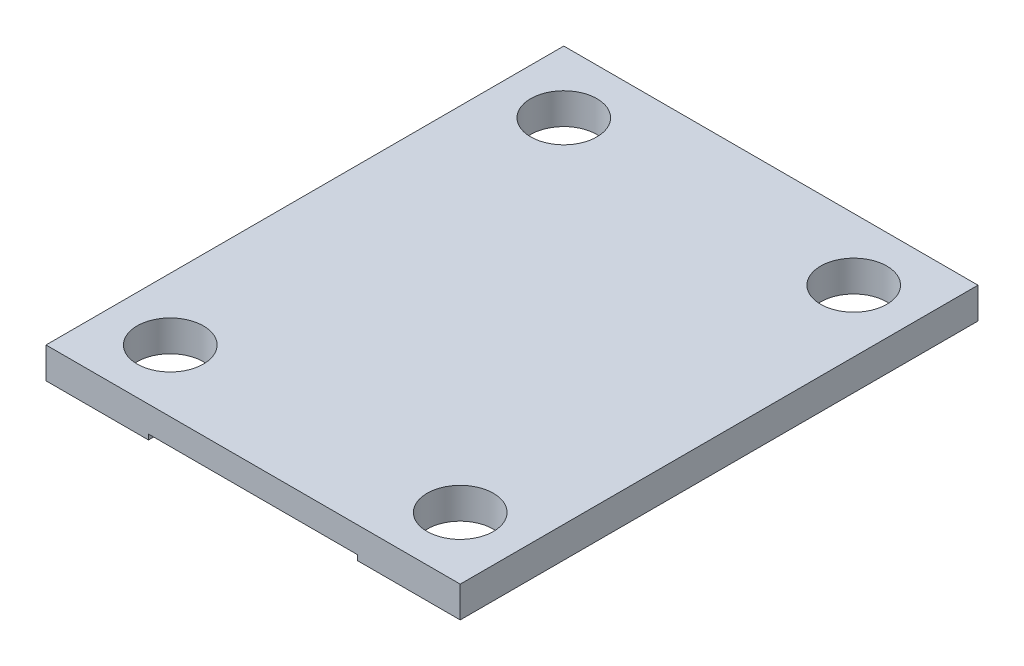
from build123d import *

# Parameters (mm, degrees)
SKETCH_1_W              = 20
SKETCH_1_H              = 25
EXTRUDE_1_DEPTH         = 1.5
SKETCH_2_W              = 10.1
SKETCH_2_H              = 17.5
CUT_EXTRUDE_1_DEPTH     = 0.25
HOLE_WIZARD_3_2_3_2_1_D = 3.2
HOLE_WIZARD_3_2_3_2_2_D = 3.2


with BuildPart() as part:
    # 草图1 → 凸台-拉伸1 (new body)
    with BuildSketch(Plane.XZ):
        with Locations((0, -2.5)):
            Rectangle(SKETCH_1_W, SKETCH_1_H)
    extrude(amount=-EXTRUDE_1_DEPTH)

    # 草图2 → 切除-拉伸1 (cut)
    with BuildSketch(Plane.XZ):
        with Locations((0, 1.25)):
            Rectangle(SKETCH_2_W, SKETCH_2_H)
    extrude(amount=-CUT_EXTRUDE_1_DEPTH, mode=Mode.SUBTRACT)

    # Ø3.2 (3.2) 直径孔1 (through all)
    with Locations(Plane(origin=(0, 0, 0), x_dir=(-1, 0, 0), z_dir=(0, -1, 0))):
        with Locations((-7, -7), (-7, 12)):
            Hole(HOLE_WIZARD_3_2_3_2_1_D / 2)

    # Ø3.2 (3.2) 直径孔2 (through all)
    with Locations(Plane(origin=(0, 1.5, 0), x_dir=(1, 0, 0), z_dir=(0, 1, 0))):
        with Locations((-7, -7), (-7, 12)):
            Hole(HOLE_WIZARD_3_2_3_2_2_D / 2)


solid = part.part
